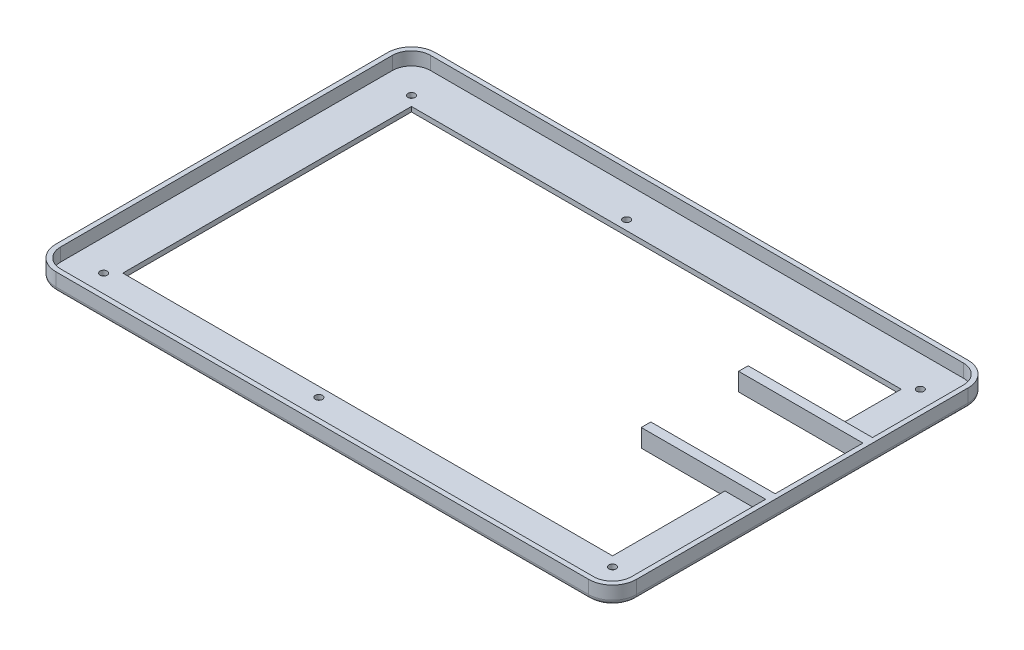
from build123d import *

# Parameters (mm, degrees)
SKIZZE1_W                          = 242.8
SKIZZE1_H                          = 158.7
AUFSATZ_LINEAR_AUSTRAGEN1_DEPTH    = 7.5
VERRUNDUNG1_R                      = 10
WANDUNG1_T                         = -2
F_3_0_3_DURCHMESSER_BOHRUNG1_D     = 3
F_3_0_3_DURCHMESSER_BOHRUNG1_DEPTH = 6
F_3_0_3_DURCHMESSER_BOHRUNG1_TIP   = 0.901290929
SKIZZE5_W                          = 204.8
SKIZZE5_H                          = 120.7
SCHNITT_LINEAR_AUSTRAGEN1_DEPTH    = 291.116838532
VERRUNDUNG2_R                      = 2
SKIZZE6_W                          = 17
SKIZZE6_H                          = 36.7
SCHNITT_LINEAR_AUSTRAGEN2_DEPTH    = 7.5
AUFSATZ_LINEAR_START               = -2
SKIZZE8_W                          = 52
SKIZZE8_H                          = 4
AUFSATZ_LINEAR_AUSTRAGEN2_DEPTH    = 7.5


with BuildPart() as part:
    # Skizze1 → Aufsatz-Linear austragen1 (new body)
    with BuildSketch(Plane(origin=(0, 0, 0), x_dir=(1, 0, 0), z_dir=(0, 1, 0))):
        with Locations((121.4, 79.35)):
            Rectangle(SKIZZE1_W, SKIZZE1_H)
    extrude(amount=AUFSATZ_LINEAR_AUSTRAGEN1_DEPTH)

    # Verrundung1
    verrundung1_edges = [part.edges().sort_by_distance(p)[0] for p in [
        (0, 3.75, -158.7),
        (242.8, 3.75, -158.7),
        (242.8, 3.75, 0),
        (0, 3.75, 0),
    ]]
    fillet(verrundung1_edges, radius=VERRUNDUNG1_R)

    # Wandung1
    wandung1_openings = [part.faces().sort_by_distance(p)[0] for p in [
        (121.4, 7.5, -79.35),
    ]]
    offset(amount=WANDUNG1_T, openings=wandung1_openings, kind=Kind.INTERSECTION)

    # Ø3.0 (3) Durchmesser Bohrung1
    with Locations(Plane(origin=(0, 2, 0), x_dir=(1, 0, 0), z_dir=(0, 1, 0))):
        with Locations((15, 143.7), (105, 143.7), (227.8, 143.7), (227.8, 15), (105, 15), (15, 15)):
            Hole(F_3_0_3_DURCHMESSER_BOHRUNG1_D / 2, depth=F_3_0_3_DURCHMESSER_BOHRUNG1_DEPTH)
            with Locations((0, 0, -(F_3_0_3_DURCHMESSER_BOHRUNG1_DEPTH + F_3_0_3_DURCHMESSER_BOHRUNG1_TIP / 2))):  # 118° drill point
                Cone(0, F_3_0_3_DURCHMESSER_BOHRUNG1_D / 2, F_3_0_3_DURCHMESSER_BOHRUNG1_TIP, mode=Mode.SUBTRACT)

    # Skizze5 → Schnitt-Linear austragen1 (cut, through all)
    with BuildSketch(Plane(origin=(0, 2, 0), x_dir=(1, 0, 0), z_dir=(0, 1, 0))):
        with Locations((121.4, 79.35)):
            Rectangle(SKIZZE5_W, SKIZZE5_H)
    extrude(amount=-SCHNITT_LINEAR_AUSTRAGEN1_DEPTH, mode=Mode.SUBTRACT)

    # Verrundung2
    verrundung2_edges = [part.edges().sort_by_distance(p)[0] for p in [
        (0, 0, -79.35),
        (121.4, 0, -158.7),
        (242.8, 0, -79.35),
        (121.4, 0, 0),
        (239.871067812, 0, -2.928932188),
        (2.928932188, 0, -2.928932188),
        (239.871067812, 0, -155.771067812),
        (2.928932188, 0, -155.771067812),
    ]]
    fillet(verrundung2_edges, radius=VERRUNDUNG2_R)

    # Skizze6 → Schnitt-Linear austragen2 (cut)
    with BuildSketch(Plane.XZ):
        with Locations((232.3, -88.35)):
            Rectangle(SKIZZE6_W, SKIZZE6_H)
    extrude(amount=-SCHNITT_LINEAR_AUSTRAGEN2_DEPTH, mode=Mode.SUBTRACT)

    # Skizze8 → Aufsatz-Linear austragen2 (add)
    with BuildSketch(Plane(origin=(0, 2, 0), x_dir=(1, 0, 0), z_dir=(0, 1, 0)).offset(AUFSATZ_LINEAR_START)):
        with Locations((214.8, 108.7)):
            Rectangle(SKIZZE8_W, SKIZZE8_H)
        with Locations((214.8, 68)):
            Rectangle(SKIZZE8_W, SKIZZE8_H)
    extrude(amount=AUFSATZ_LINEAR_AUSTRAGEN2_DEPTH)


solid = part.part
